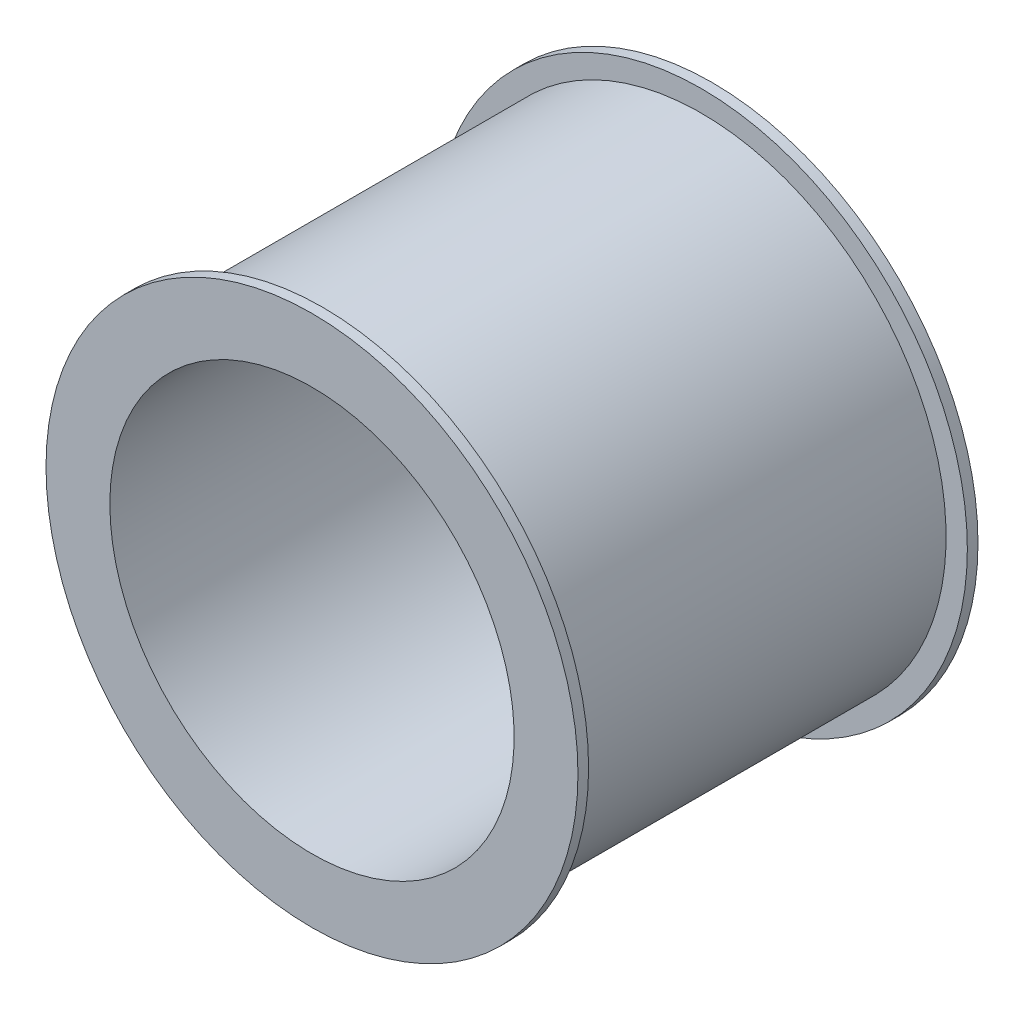
from build123d import *

# Parameters (mm, degrees)
SKETCH1_R           = 11.5
SKETCH1_R_2         = 9.5
BOSS_EXTRUDE1_DEPTH = 18.8
BOSS_EXTRUDE3_START = -0.5
SKETCH2_R           = 12.5
SKETCH2_R_2         = 11.5
BOSS_EXTRUDE3_DEPTH = 0.5
SKETCH3_R           = 12.5
SKETCH3_R_2         = 11.5
BOSS_EXTRUDE4_DEPTH = 0.5


with BuildPart() as part:
    # Sketch1 → Boss-Extrude1 (new body)
    with BuildSketch(Plane.XY):
        with Locations(Location((0, 0, 0), (0, 0, 180))):
            Circle(SKETCH1_R)
        with Locations(Location((0, 0, 0), (0, 0, 180))):
            Circle(SKETCH1_R_2, mode=Mode.SUBTRACT)
    extrude(amount=BOSS_EXTRUDE1_DEPTH)

    # Sketch2 → Boss-Extrude3 (add)
    with BuildSketch(Plane.XY.offset(18.8).offset(BOSS_EXTRUDE3_START)):
        Circle(SKETCH2_R)
        with Locations(Location((0, 0, 0), (0, 0, 180))):
            Circle(SKETCH2_R_2, mode=Mode.SUBTRACT)
    extrude(amount=BOSS_EXTRUDE3_DEPTH)

    # Sketch3 → Boss-Extrude4 (add)
    with BuildSketch(Plane(origin=(0, 0, 0), x_dir=(-1, 0, 0), z_dir=(0, 0, -1))):
        with Locations(Location((0, 0, 0), (0, 0, 180))):
            Circle(SKETCH3_R)
        Circle(SKETCH3_R_2, mode=Mode.SUBTRACT)
    extrude(amount=-BOSS_EXTRUDE4_DEPTH)


solid = part.part
